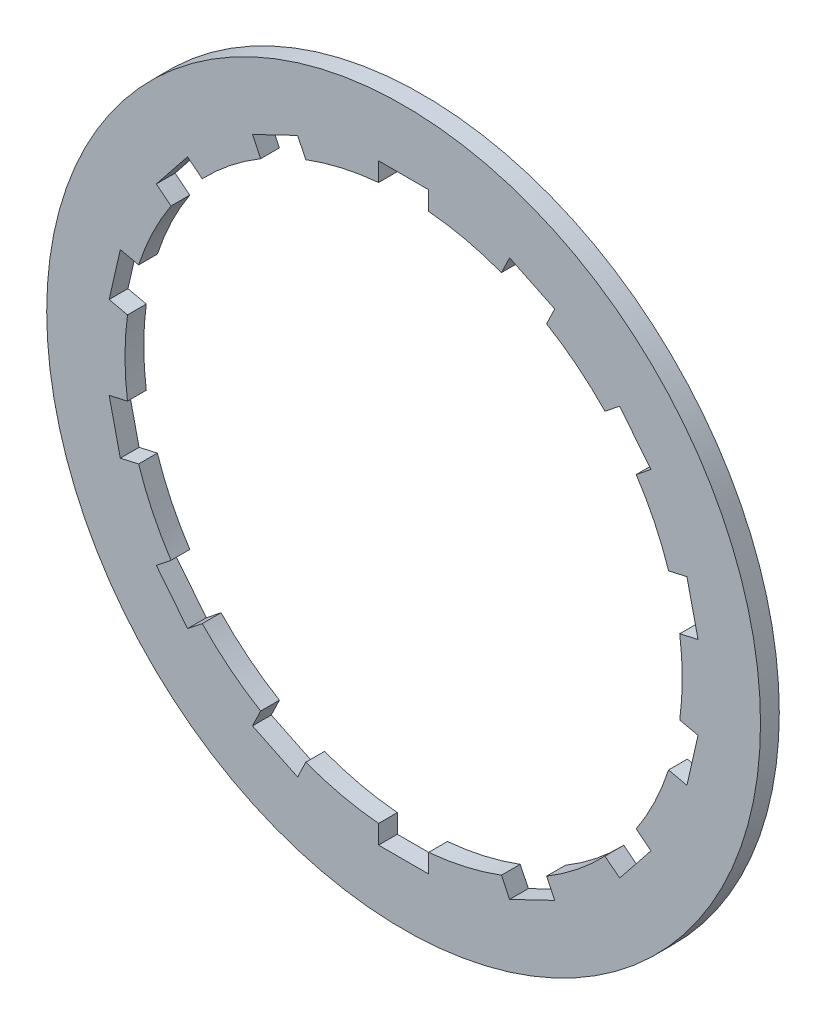
from build123d import *

# Parameters (mm, degrees)
SKETCH1_R           = 57
SKETCH1_R_2         = 44.5
BOSS_EXTRUDE1_DEPTH = 3
CUT_EXTRUDE1_REACH  = 82.666
SKETCH3_W           = 8
SKETCH3_H           = 3
CIRPATTERN1_COUNT   = 14


with BuildPart() as part:
    # Sketch1 → Boss-Extrude1 (new body)
    with BuildSketch(Plane.XY):
        Circle(SKETCH1_R)
        Circle(SKETCH1_R_2, mode=Mode.SUBTRACT)
    extrude(amount=BOSS_EXTRUDE1_DEPTH)

    # Sketch3 → Cut-Extrude1 (cut, up to next)
    with BuildSketch(Plane.XY.offset(3), mode=Mode.PRIVATE) as cut_extrude1_sk1:
        with Locations((0, 45.819860108)):
            Rectangle(SKETCH3_W, SKETCH3_H)
    cut_extrude1_tool1 = extrude(cut_extrude1_sk1.sketch, amount=-CUT_EXTRUDE1_REACH, mode=Mode.PRIVATE) & part.part
    cut_extrude1 = cut_extrude1_tool1.solids().sort_by_distance((0, 45.81986, 3))[0]
    add(cut_extrude1, mode=Mode.SUBTRACT)

    # CirPattern1: Cut-Extrude1 ×14 about axis
    cirpattern1_axis = Axis((0, 0, 0), (0, 0, 1))
    for i in range(1, CIRPATTERN1_COUNT):
        add(cut_extrude1.rotate(cirpattern1_axis, i * 360 / CIRPATTERN1_COUNT), mode=Mode.SUBTRACT)


solid = part.part
